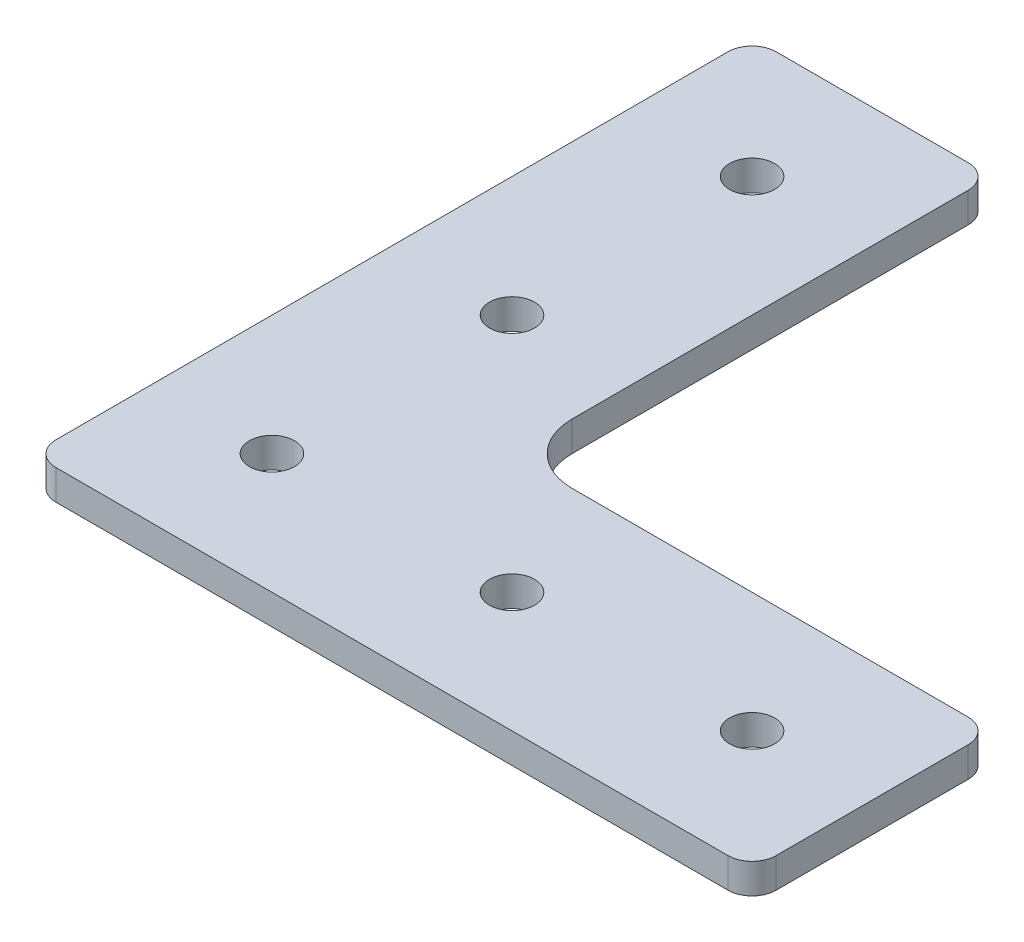
from build123d import *

# Parameters (mm, degrees)
SKETCH1_R           = 2.38125
BOSS_EXTRUDE1_DEPTH = 3.175


with BuildPart() as part:
    # Sketch1 → Boss-Extrude1 (new body)
    with BuildSketch(Plane(origin=(0, 0, 0), x_dir=(1, 0, 0), z_dir=(0, 1, 0))):
        with BuildLine():
            Line((-10.16, -38.1), (6.35, -38.1))
            Line((6.35, -38.1), (60.96, -38.1))
            ThreePointArc((60.96, -38.1), (62.756051224, -37.356051224), (63.5, -35.56))
            Line((63.5, -35.56), (63.5, -15.24))
            ThreePointArc((63.5, -15.24), (62.756051224, -13.443948776), (60.96, -12.7))
            Line((60.96, -12.7), (19.05, -12.7))
            ThreePointArc((19.05, -12.7), (14.559871939, -10.840128061), (12.7, -6.35))
            Line((12.7, -6.35), (12.7, 35.56))
            ThreePointArc((12.7, 35.56), (11.956051224, 37.356051224), (10.16, 38.1))
            Line((10.16, 38.1), (-10.16, 38.1))
            ThreePointArc((-10.16, 38.1), (-11.956051224, 37.356051224), (-12.7, 35.56))
            Line((-12.7, 35.56), (-12.7, -35.56))
            ThreePointArc((-12.7, -35.56), (-11.956051224, -37.356051224), (-10.16, -38.1))
        make_face()
        with Locations(Location((0, -25.4, 0), (0, 0, 270))):
            Circle(SKETCH1_R, mode=Mode.SUBTRACT)
        with Locations(Location((0, 0, 0), (0, 0, 270))):
            Circle(SKETCH1_R, mode=Mode.SUBTRACT)
        with Locations(Location((0, 25.4, 0), (0, 0, 270))):
            Circle(SKETCH1_R, mode=Mode.SUBTRACT)
        with Locations(Location((25.4, -25.4, 0), (0, 0, 270))):
            Circle(SKETCH1_R, mode=Mode.SUBTRACT)
        with Locations(Location((50.8, -25.4, 0), (0, 0, 270))):
            Circle(SKETCH1_R, mode=Mode.SUBTRACT)
    extrude(amount=BOSS_EXTRUDE1_DEPTH)


solid = part.part
